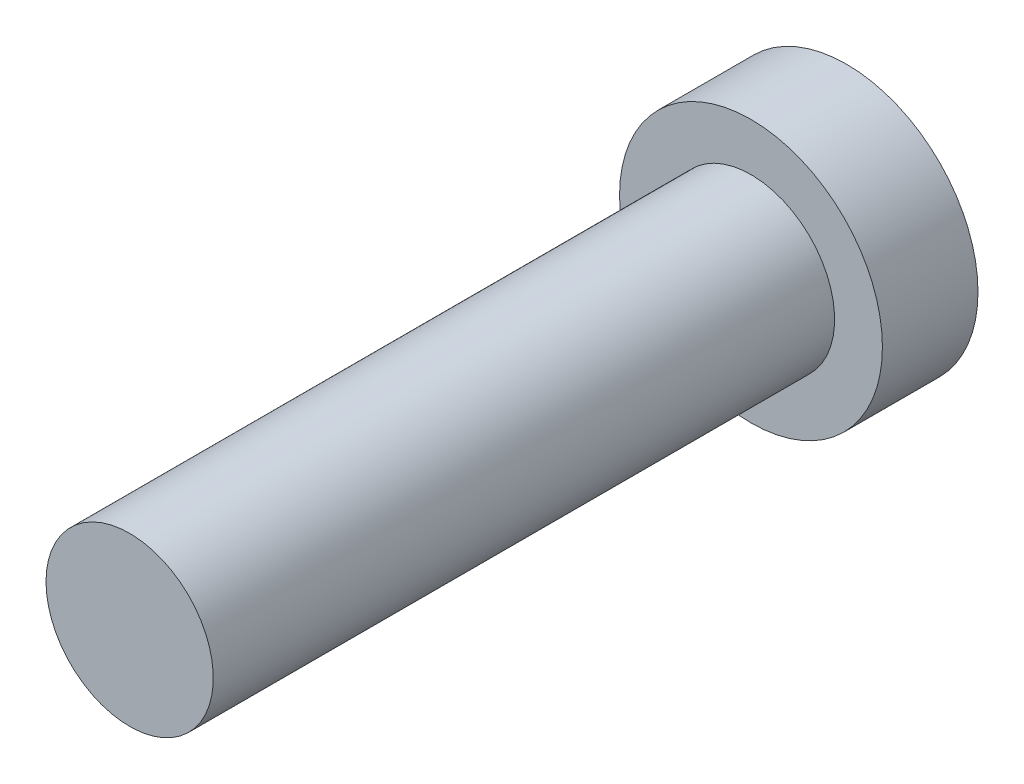
from build123d import *

# Parameters (mm, degrees)
SKETCH_1_R      = 2.75
EXTRUDE_1_DEPTH = 2
SKETCH_2_R      = 1.75
EXTRUDE_2_DEPTH = 13


with BuildPart() as part:
    # 草圖1 → 伸長1 (new body)
    with BuildSketch(Plane.XY):
        Circle(SKETCH_1_R)
    extrude(amount=EXTRUDE_1_DEPTH)

    # 草圖2 → 伸長2 (add)
    with BuildSketch(Plane.XY.offset(2)):
        with Locations(Location((0, 0, 0), (0, 0, 180))):
            Circle(SKETCH_2_R)
    extrude(amount=EXTRUDE_2_DEPTH)


solid = part.part
